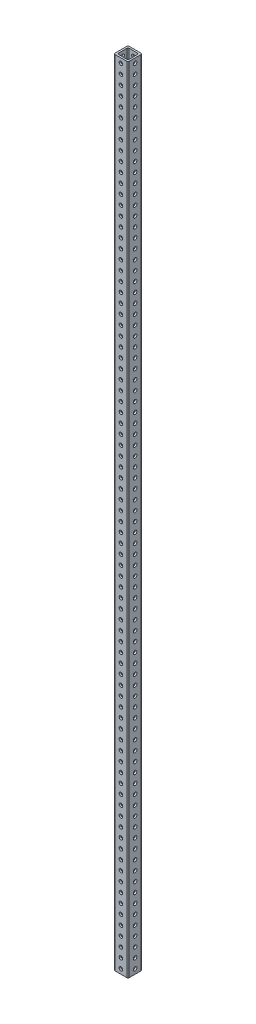
from build123d import *

# Parameters (mm, degrees)
SKETCH1_W           = 38.1
SKETCH1_H           = 38.1
SKETCH1_W_2         = 28.575
SKETCH1_H_2         = 28.575
BOSS_EXTRUDE1_DEPTH = 2133.6
FILLET1_R           = 3.175
SKETCH2_R           = 4.7625
CUT_EXTRUDE1_DEPTH  = 50.8
SKETCH3_R           = 4.7625
CUT_EXTRUDE2_DEPTH  = 50.8


with BuildPart() as part:
    # Sketch1 → Boss-Extrude1 (new body)
    with BuildSketch(Plane(origin=(0, 0, 0), x_dir=(1, 0, 0), z_dir=(0, 1, 0))):
        with Locations((19.05, -19.05)):
            Rectangle(SKETCH1_W, SKETCH1_H)
        with Locations((19.05, -19.05)):
            Rectangle(SKETCH1_W_2, SKETCH1_H_2, mode=Mode.SUBTRACT)
    extrude(amount=BOSS_EXTRUDE1_DEPTH)

    # Fillet1
    fillet1_edges = [part.edges().sort_by_distance(p)[0] for p in [
        (4.7625, 1066.8, 4.7625),
        (4.7625, 1066.8, 33.3375),
        (33.3375, 1066.8, 33.3375),
        (33.3375, 1066.8, 4.7625),
        (0, 1066.8, 0),
        (38.1, 1066.8, 0),
        (38.1, 1066.8, 38.1),
        (0, 1066.8, 38.1),
    ]]
    fillet(fillet1_edges, radius=FILLET1_R)

    # Sketch2 → Cut-Extrude1 (cut)
    with BuildSketch(Plane.XY.offset(38.1)):
        with Locations((19.05, 2120.9)):
            Circle(SKETCH2_R)
        with Locations((19.05, 2095.5)):
            Circle(SKETCH2_R)
        with Locations((19.05, 2070.1)):
            Circle(SKETCH2_R)
        with Locations((19.05, 2044.7)):
            Circle(SKETCH2_R)
        with Locations((19.05, 2019.3)):
            Circle(SKETCH2_R)
        with Locations((19.05, 1993.9)):
            Circle(SKETCH2_R)
        with Locations((19.05, 1968.5)):
            Circle(SKETCH2_R)
        with Locations((19.05, 1943.1)):
            Circle(SKETCH2_R)
        with Locations((19.05, 1917.7)):
            Circle(SKETCH2_R)
        with Locations((19.05, 1892.3)):
            Circle(SKETCH2_R)
        with Locations((19.05, 1866.9)):
            Circle(SKETCH2_R)
        with Locations((19.05, 1841.5)):
            Circle(SKETCH2_R)
        with Locations((19.05, 1816.1)):
            Circle(SKETCH2_R)
        with Locations((19.05, 1790.7)):
            Circle(SKETCH2_R)
        with Locations((19.05, 1765.3)):
            Circle(SKETCH2_R)
        with Locations((19.05, 1739.9)):
            Circle(SKETCH2_R)
        with Locations((19.05, 1714.5)):
            Circle(SKETCH2_R)
        with Locations((19.05, 1689.1)):
            Circle(SKETCH2_R)
        with Locations((19.05, 1663.7)):
            Circle(SKETCH2_R)
        with Locations((19.05, 1638.3)):
            Circle(SKETCH2_R)
        with Locations((19.05, 1612.9)):
            Circle(SKETCH2_R)
        with Locations((19.05, 1587.5)):
            Circle(SKETCH2_R)
        with Locations((19.05, 1562.1)):
            Circle(SKETCH2_R)
        with Locations((19.05, 1536.7)):
            Circle(SKETCH2_R)
        with Locations((19.05, 1511.3)):
            Circle(SKETCH2_R)
        with Locations((19.05, 1485.9)):
            Circle(SKETCH2_R)
        with Locations((19.05, 1460.5)):
            Circle(SKETCH2_R)
        with Locations((19.05, 1435.1)):
            Circle(SKETCH2_R)
        with Locations((19.05, 1409.7)):
            Circle(SKETCH2_R)
        with Locations((19.05, 1384.3)):
            Circle(SKETCH2_R)
        with Locations((19.05, 1358.9)):
            Circle(SKETCH2_R)
        with Locations((19.05, 1333.5)):
            Circle(SKETCH2_R)
        with Locations((19.05, 1308.1)):
            Circle(SKETCH2_R)
        with Locations((19.05, 1282.7)):
            Circle(SKETCH2_R)
        with Locations((19.05, 1257.3)):
            Circle(SKETCH2_R)
        with Locations((19.05, 1231.9)):
            Circle(SKETCH2_R)
        with Locations((19.05, 1206.5)):
            Circle(SKETCH2_R)
        with Locations((19.05, 1181.1)):
            Circle(SKETCH2_R)
        with Locations((19.05, 1155.7)):
            Circle(SKETCH2_R)
        with Locations((19.05, 1130.3)):
            Circle(SKETCH2_R)
        with Locations((19.05, 1104.9)):
            Circle(SKETCH2_R)
        with Locations((19.05, 1079.5)):
            Circle(SKETCH2_R)
        with Locations((19.05, 1054.1)):
            Circle(SKETCH2_R)
        with Locations((19.05, 1028.7)):
            Circle(SKETCH2_R)
        with Locations((19.05, 1003.3)):
            Circle(SKETCH2_R)
        with Locations((19.05, 977.9)):
            Circle(SKETCH2_R)
        with Locations((19.05, 952.5)):
            Circle(SKETCH2_R)
        with Locations((19.05, 927.1)):
            Circle(SKETCH2_R)
        with Locations((19.05, 901.7)):
            Circle(SKETCH2_R)
        with Locations((19.05, 876.3)):
            Circle(SKETCH2_R)
        with Locations((19.05, 850.9)):
            Circle(SKETCH2_R)
        with Locations((19.05, 825.5)):
            Circle(SKETCH2_R)
        with Locations((19.05, 800.1)):
            Circle(SKETCH2_R)
        with Locations((19.05, 774.7)):
            Circle(SKETCH2_R)
        with Locations((19.05, 749.3)):
            Circle(SKETCH2_R)
        with Locations((19.05, 723.9)):
            Circle(SKETCH2_R)
        with Locations((19.05, 698.5)):
            Circle(SKETCH2_R)
        with Locations((19.05, 673.1)):
            Circle(SKETCH2_R)
        with Locations((19.05, 647.7)):
            Circle(SKETCH2_R)
        with Locations((19.05, 622.3)):
            Circle(SKETCH2_R)
        with Locations((19.05, 596.9)):
            Circle(SKETCH2_R)
        with Locations((19.05, 571.5)):
            Circle(SKETCH2_R)
        with Locations((19.05, 546.1)):
            Circle(SKETCH2_R)
        with Locations((19.05, 520.7)):
            Circle(SKETCH2_R)
        with Locations((19.05, 495.3)):
            Circle(SKETCH2_R)
        with Locations((19.05, 469.9)):
            Circle(SKETCH2_R)
        with Locations((19.05, 444.5)):
            Circle(SKETCH2_R)
        with Locations((19.05, 419.1)):
            Circle(SKETCH2_R)
        with Locations((19.05, 393.7)):
            Circle(SKETCH2_R)
        with Locations((19.05, 368.3)):
            Circle(SKETCH2_R)
        with Locations((19.05, 342.9)):
            Circle(SKETCH2_R)
        with Locations((19.05, 317.5)):
            Circle(SKETCH2_R)
        with Locations((19.05, 292.1)):
            Circle(SKETCH2_R)
        with Locations((19.05, 266.7)):
            Circle(SKETCH2_R)
        with Locations((19.05, 241.3)):
            Circle(SKETCH2_R)
        with Locations((19.05, 215.9)):
            Circle(SKETCH2_R)
        with Locations((19.05, 190.5)):
            Circle(SKETCH2_R)
        with Locations((19.05, 165.1)):
            Circle(SKETCH2_R)
        with Locations((19.05, 139.7)):
            Circle(SKETCH2_R)
        with Locations((19.05, 114.3)):
            Circle(SKETCH2_R)
        with Locations((19.05, 88.9)):
            Circle(SKETCH2_R)
        with Locations((19.05, 63.5)):
            Circle(SKETCH2_R)
        with Locations((19.05, 38.1)):
            Circle(SKETCH2_R)
        with Locations((19.05, 12.7)):
            Circle(SKETCH2_R)
    extrude(amount=-CUT_EXTRUDE1_DEPTH, mode=Mode.SUBTRACT)

    # Sketch3 → Cut-Extrude2 (cut)
    with BuildSketch(Plane.ZY):
        with Locations((19.05, 2120.9)):
            Circle(SKETCH3_R)
        with Locations((19.05, 2095.5)):
            Circle(SKETCH3_R)
        with Locations((19.05, 2070.1)):
            Circle(SKETCH3_R)
        with Locations((19.05, 2044.7)):
            Circle(SKETCH3_R)
        with Locations((19.05, 2019.3)):
            Circle(SKETCH3_R)
        with Locations((19.05, 1993.9)):
            Circle(SKETCH3_R)
        with Locations((19.05, 1968.5)):
            Circle(SKETCH3_R)
        with Locations((19.05, 1943.1)):
            Circle(SKETCH3_R)
        with Locations((19.05, 1917.7)):
            Circle(SKETCH3_R)
        with Locations((19.05, 1892.3)):
            Circle(SKETCH3_R)
        with Locations((19.05, 1866.9)):
            Circle(SKETCH3_R)
        with Locations((19.05, 1841.5)):
            Circle(SKETCH3_R)
        with Locations((19.05, 1816.1)):
            Circle(SKETCH3_R)
        with Locations((19.05, 1790.7)):
            Circle(SKETCH3_R)
        with Locations((19.05, 1765.3)):
            Circle(SKETCH3_R)
        with Locations((19.05, 1739.9)):
            Circle(SKETCH3_R)
        with Locations((19.05, 1714.5)):
            Circle(SKETCH3_R)
        with Locations((19.05, 1689.1)):
            Circle(SKETCH3_R)
        with Locations((19.05, 1663.7)):
            Circle(SKETCH3_R)
        with Locations((19.05, 1638.3)):
            Circle(SKETCH3_R)
        with Locations((19.05, 1612.9)):
            Circle(SKETCH3_R)
        with Locations((19.05, 1587.5)):
            Circle(SKETCH3_R)
        with Locations((19.05, 1562.1)):
            Circle(SKETCH3_R)
        with Locations((19.05, 1536.7)):
            Circle(SKETCH3_R)
        with Locations((19.05, 1511.3)):
            Circle(SKETCH3_R)
        with Locations((19.05, 1485.9)):
            Circle(SKETCH3_R)
        with Locations((19.05, 1460.5)):
            Circle(SKETCH3_R)
        with Locations((19.05, 1435.1)):
            Circle(SKETCH3_R)
        with Locations((19.05, 1409.7)):
            Circle(SKETCH3_R)
        with Locations((19.05, 1384.3)):
            Circle(SKETCH3_R)
        with Locations((19.05, 1358.9)):
            Circle(SKETCH3_R)
        with Locations((19.05, 1333.5)):
            Circle(SKETCH3_R)
        with Locations((19.05, 1308.1)):
            Circle(SKETCH3_R)
        with Locations((19.05, 1282.7)):
            Circle(SKETCH3_R)
        with Locations((19.05, 1257.3)):
            Circle(SKETCH3_R)
        with Locations((19.05, 1231.9)):
            Circle(SKETCH3_R)
        with Locations((19.05, 1206.5)):
            Circle(SKETCH3_R)
        with Locations((19.05, 1181.1)):
            Circle(SKETCH3_R)
        with Locations((19.05, 1155.7)):
            Circle(SKETCH3_R)
        with Locations((19.05, 1130.3)):
            Circle(SKETCH3_R)
        with Locations((19.05, 1104.9)):
            Circle(SKETCH3_R)
        with Locations((19.05, 1079.5)):
            Circle(SKETCH3_R)
        with Locations((19.05, 1054.1)):
            Circle(SKETCH3_R)
        with Locations((19.05, 1028.7)):
            Circle(SKETCH3_R)
        with Locations((19.05, 1003.3)):
            Circle(SKETCH3_R)
        with Locations((19.05, 977.9)):
            Circle(SKETCH3_R)
        with Locations((19.05, 952.5)):
            Circle(SKETCH3_R)
        with Locations((19.05, 927.1)):
            Circle(SKETCH3_R)
        with Locations((19.05, 901.7)):
            Circle(SKETCH3_R)
        with Locations((19.05, 876.3)):
            Circle(SKETCH3_R)
        with Locations((19.05, 850.9)):
            Circle(SKETCH3_R)
        with Locations((19.05, 825.5)):
            Circle(SKETCH3_R)
        with Locations((19.05, 800.1)):
            Circle(SKETCH3_R)
        with Locations((19.05, 774.7)):
            Circle(SKETCH3_R)
        with Locations((19.05, 749.3)):
            Circle(SKETCH3_R)
        with Locations((19.05, 723.9)):
            Circle(SKETCH3_R)
        with Locations((19.05, 698.5)):
            Circle(SKETCH3_R)
        with Locations((19.05, 673.1)):
            Circle(SKETCH3_R)
        with Locations((19.05, 647.7)):
            Circle(SKETCH3_R)
        with Locations((19.05, 622.3)):
            Circle(SKETCH3_R)
        with Locations((19.05, 596.9)):
            Circle(SKETCH3_R)
        with Locations((19.05, 571.5)):
            Circle(SKETCH3_R)
        with Locations((19.05, 546.1)):
            Circle(SKETCH3_R)
        with Locations((19.05, 520.7)):
            Circle(SKETCH3_R)
        with Locations((19.05, 495.3)):
            Circle(SKETCH3_R)
        with Locations((19.05, 469.9)):
            Circle(SKETCH3_R)
        with Locations((19.05, 444.5)):
            Circle(SKETCH3_R)
        with Locations((19.05, 419.1)):
            Circle(SKETCH3_R)
        with Locations((19.05, 393.7)):
            Circle(SKETCH3_R)
        with Locations((19.05, 368.3)):
            Circle(SKETCH3_R)
        with Locations((19.05, 342.9)):
            Circle(SKETCH3_R)
        with Locations((19.05, 317.5)):
            Circle(SKETCH3_R)
        with Locations((19.05, 292.1)):
            Circle(SKETCH3_R)
        with Locations((19.05, 266.7)):
            Circle(SKETCH3_R)
        with Locations((19.05, 241.3)):
            Circle(SKETCH3_R)
        with Locations((19.05, 215.9)):
            Circle(SKETCH3_R)
        with Locations((19.05, 190.5)):
            Circle(SKETCH3_R)
        with Locations((19.05, 165.1)):
            Circle(SKETCH3_R)
        with Locations((19.05, 139.7)):
            Circle(SKETCH3_R)
        with Locations((19.05, 114.3)):
            Circle(SKETCH3_R)
        with Locations((19.05, 88.9)):
            Circle(SKETCH3_R)
        with Locations((19.05, 63.5)):
            Circle(SKETCH3_R)
        with Locations((19.05, 38.1)):
            Circle(SKETCH3_R)
        with Locations((19.05, 12.7)):
            Circle(SKETCH3_R)
    extrude(amount=-CUT_EXTRUDE2_DEPTH, mode=Mode.SUBTRACT)


solid = part.part
